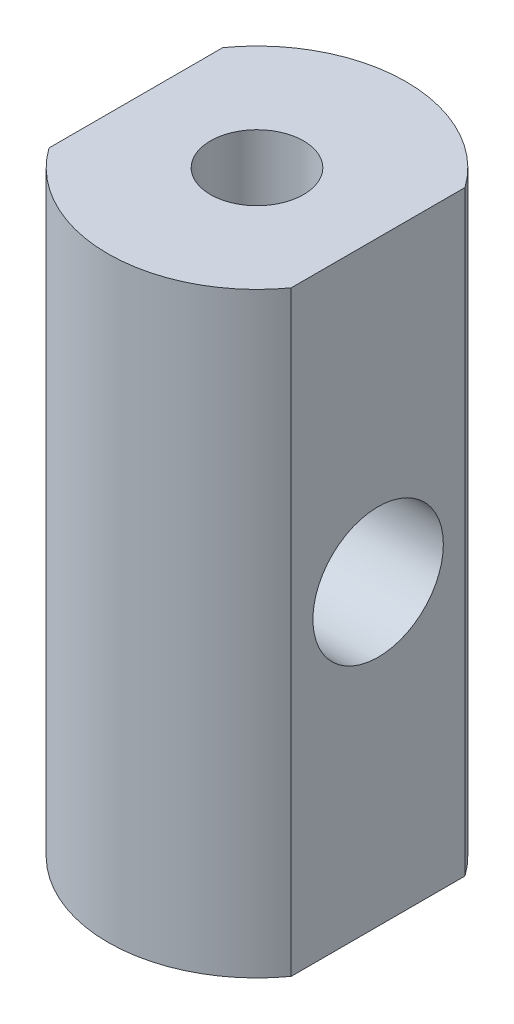
from build123d import *

# Parameters (mm, degrees)
SKETCH_1_R               = 8
EXTRUDE_1_DEPTH          = 32
M6X1_0_1_D               = 5
M6X1_0_1_DEPTH           = 6
M6X1_0_1_TIP             = 1.502151548
M6X1_0_2_D               = 5
M6X1_0_2_DEPTH           = 6
M6X1_0_2_TIP             = 1.502151548
CUT_EXTRUDE_2_DEPTH      = 10
CUT_EXTRUDE_2_DEPTH_BACK = 10
SKETCH_10_W              = 1.5
SKETCH_10_H              = 35
M8X1_0_1_D               = 7


with BuildPart() as part:
    # 草图1 → 凸台-拉伸1 (new body)
    with BuildSketch(Plane(origin=(0, 0, 0), x_dir=(1, 0, 0), z_dir=(0, 1, 0))):
        Circle(SKETCH_1_R)
    extrude(amount=EXTRUDE_1_DEPTH)

    # M6x1.0 螺纹孔1
    with Locations(Plane(origin=(0, 32, 0), x_dir=(1, 0, 0), z_dir=(0, 1, 0))):
        with Locations((0, 0)):
            Hole(M6X1_0_1_D / 2, depth=M6X1_0_1_DEPTH)
            with Locations((0, 0, -(M6X1_0_1_DEPTH + M6X1_0_1_TIP / 2))):  # 118° drill point
                Cone(0, M6X1_0_1_D / 2, M6X1_0_1_TIP, mode=Mode.SUBTRACT)

    # M6x1.0 螺纹孔2
    with Locations(Plane(origin=(0, 0, 0), x_dir=(-1, 0, 0), z_dir=(0, -1, 0))):
        with Locations((0, 0)):
            Hole(M6X1_0_2_D / 2, depth=M6X1_0_2_DEPTH)
            with Locations((0, 0, -(M6X1_0_2_DEPTH + M6X1_0_2_TIP / 2))):  # 118° drill point
                Cone(0, M6X1_0_2_D / 2, M6X1_0_2_TIP, mode=Mode.SUBTRACT)

    # 草图10 → 切除-拉伸2 (cut, two sides: drawn at the far end of the back side and taken through both)
    with BuildSketch(Plane.XY.offset(-CUT_EXTRUDE_2_DEPTH_BACK)):
        with Locations((7.25, 16)):
            Rectangle(SKETCH_10_W, SKETCH_10_H)
        with Locations((-7.25, 16)):
            Rectangle(SKETCH_10_W, SKETCH_10_H)
    extrude(amount=CUT_EXTRUDE_2_DEPTH + CUT_EXTRUDE_2_DEPTH_BACK, mode=Mode.SUBTRACT)

    # M8x1.0 螺纹孔1 (through all)
    with Locations(Plane(origin=(6.5, 0, 0), x_dir=(0, 0, -1), z_dir=(1, 0, 0))):
        with Locations((0, 16)):
            Hole(M8X1_0_1_D / 2)


solid = part.part
